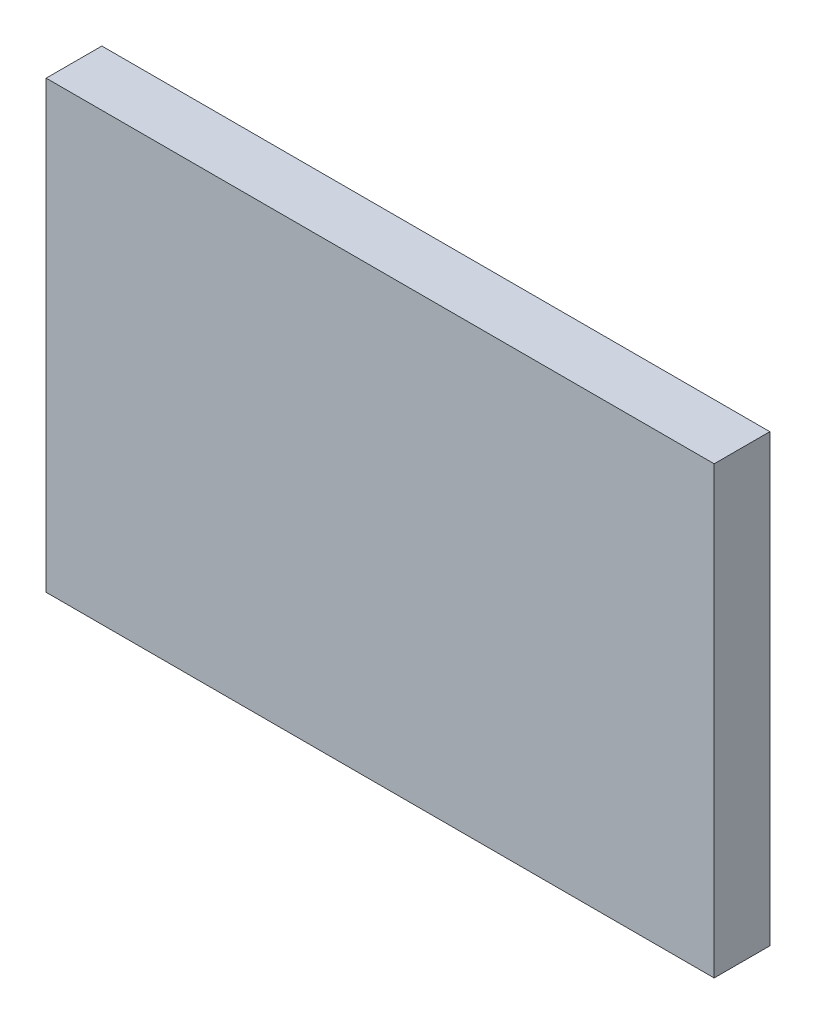
from build123d import *

# Parameters (mm, degrees)
SKETCH1_W        = 152.4
SKETCH1_H        = 101.6
BASE_BLOCK_DEPTH = 12.7


with BuildPart() as part:
    # Sketch1 → base_block (new body)
    with BuildSketch(Plane.XY):
        with Locations((76.2, 50.8)):
            Rectangle(SKETCH1_W, SKETCH1_H)
    extrude(amount=BASE_BLOCK_DEPTH)


solid = part.part
